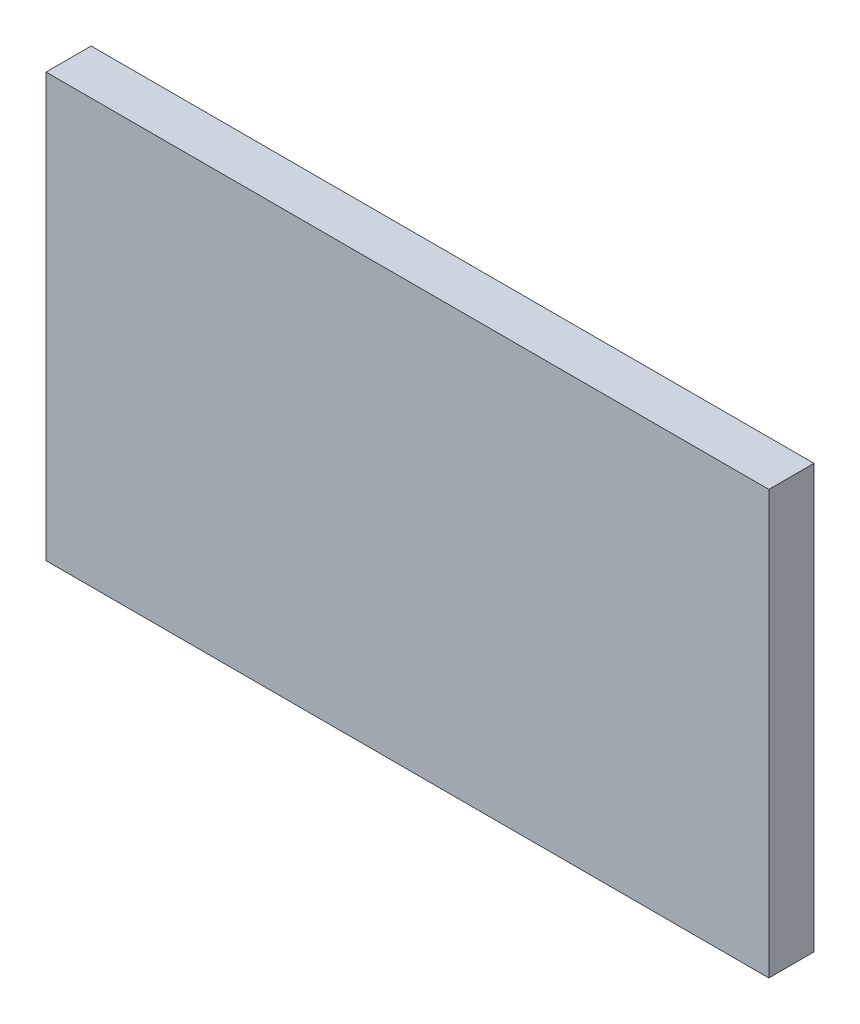
from build123d import *

# Parameters (mm, degrees)
SKETCH1_W           = 304.366355201
SKETCH1_H           = 178.172572298
BOSS_EXTRUDE1_DEPTH = 19


with BuildPart() as part:
    # Sketch1 → Boss-Extrude1 (new body)
    with BuildSketch(Plane.XY):
        with Locations((152.183177601, 89.086286149)):
            Rectangle(SKETCH1_W, SKETCH1_H)
    extrude(amount=BOSS_EXTRUDE1_DEPTH)


solid = part.part
